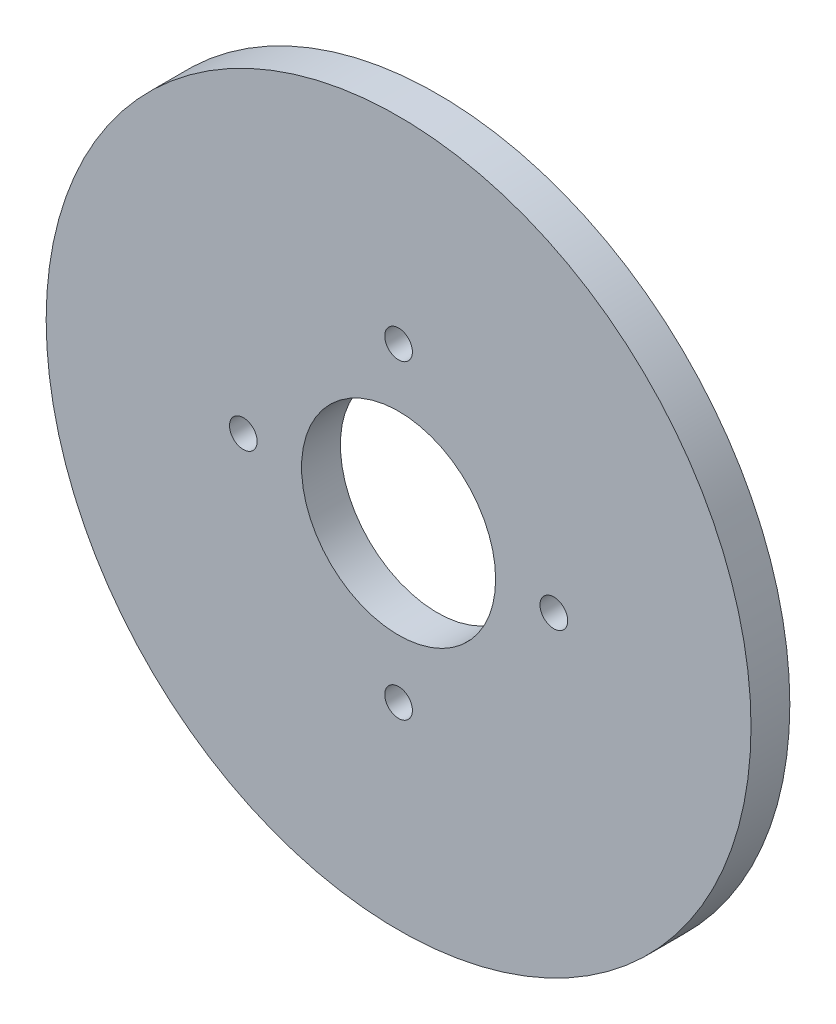
from build123d import *

# Parameters (mm, degrees)
SKETCH1_R                     = 28.829
SKETCH1_R_2                   = 7.9375
BOSS_EXTRUDE1_DEPTH           = 3.175
TAP_DRILL_FOR_4_40_TAP1_D     = 2.2606
TAP_DRILL_FOR_4_40_TAP1_DEPTH = 4
TAP_DRILL_FOR_4_40_TAP1_TIP   = 0.679152758


with BuildPart() as part:
    # Sketch1 → Boss-Extrude1 (new body)
    with BuildSketch(Plane.XY):
        Circle(SKETCH1_R)
        Circle(SKETCH1_R_2, mode=Mode.SUBTRACT)
    extrude(amount=BOSS_EXTRUDE1_DEPTH)

    # Tap Drill for #4-40 Tap1
    with Locations(Plane.XY.offset(3.175)):
        with Locations((0, 12.7), (0, -12.7), (12.7, 0), (-12.7, 0)):
            Hole(TAP_DRILL_FOR_4_40_TAP1_D / 2, depth=TAP_DRILL_FOR_4_40_TAP1_DEPTH)
            with Locations((0, 0, -(TAP_DRILL_FOR_4_40_TAP1_DEPTH + TAP_DRILL_FOR_4_40_TAP1_TIP / 2))):  # 118° drill point
                Cone(0, TAP_DRILL_FOR_4_40_TAP1_D / 2, TAP_DRILL_FOR_4_40_TAP1_TIP, mode=Mode.SUBTRACT)


solid = part.part
